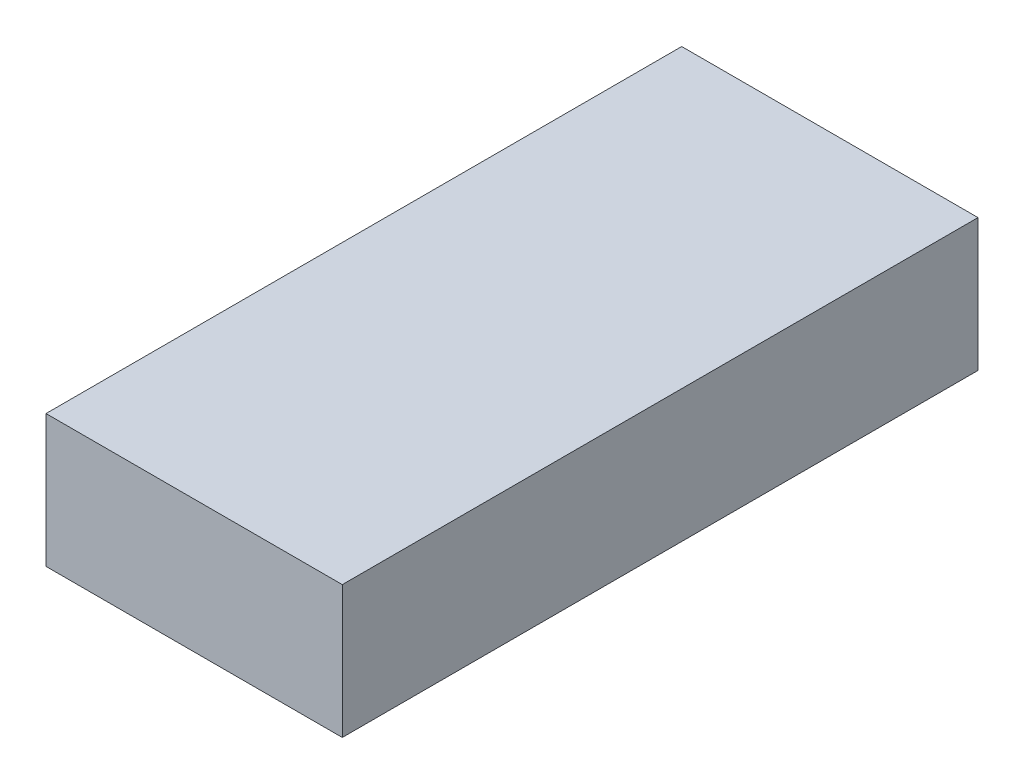
from build123d import *

# Parameters (mm, degrees)
SKETCH1_W           = 16.6624
SKETCH1_H           = 37.2872
BOSS_EXTRUDE1_DEPTH = 40


with BuildPart() as part:
    # Sketch1 → Boss-Extrude1 (new, symmetric)
    with BuildSketch(Plane(origin=(0, 0, 0), x_dir=(0, 1, 0), z_dir=(0, 0, 1))):
        Rectangle(SKETCH1_W, SKETCH1_H)
    extrude(amount=BOSS_EXTRUDE1_DEPTH, both=True)


solid = part.part
